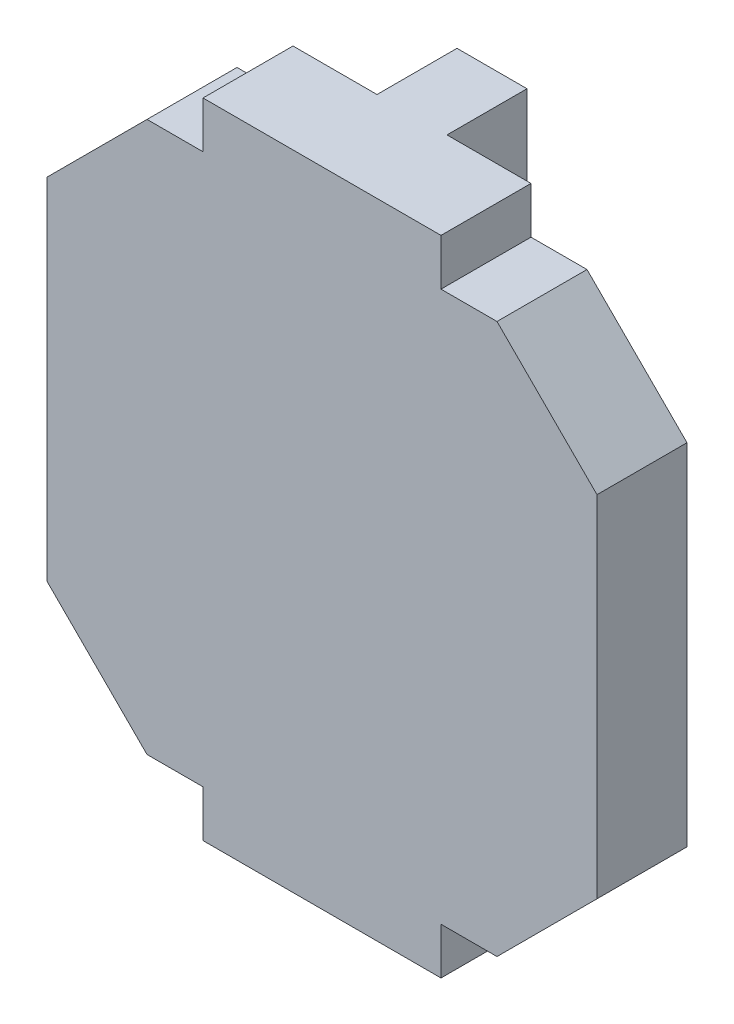
from build123d import *

# Parameters (mm, degrees)
BOSS_EXTRUDE1_DEPTH = 1.143
SKETCH2_W           = 0.889
SKETCH2_H           = 8.243996394
BOSS_EXTRUDE2_DEPTH = 1.016
CHAMFER1_SIZE       = 1.27


with BuildPart() as part:
    # Sketch1 → Boss-Extrude1 (new body)
    with BuildSketch(Plane.XY):
        Polygon((37.147499812, 66.75804972), (39.128699766, 66.758049722), (39.128699766, 66.16665148), (42.151299766, 66.166651485), (42.151299766, 66.758049727), (44.132499719, 66.758049729), (44.13249971, 73.743049637), (42.151299756, 73.743049634), (42.151299755, 74.334447876), (39.128699755, 74.334447872), (39.128699756, 73.74304963), (37.147499802, 73.743049628), align=None)
    extrude(amount=BOSS_EXTRUDE1_DEPTH)

    # Sketch2 → Boss-Extrude2 (add)
    with BuildSketch(Plane(origin=(0, 0, 0), x_dir=(-1, 0, 0), z_dir=(0, 0, -1))):
        with Locations((-40.639999755, 70.212449679)):
            Rectangle(SKETCH2_W, SKETCH2_H)
    extrude(amount=BOSS_EXTRUDE2_DEPTH)

    # Chamfer1
    chamfer1_edges = [part.edges().sort_by_distance(p)[0] for p in [
        (37.147499802, 73.743049628, 0.5715),
        (44.13249971, 73.743049637, 0.5715),
        (44.132499719, 66.758049729, 0.5715),
        (37.147499812, 66.75804972, 0.5715),
    ]]
    chamfer(chamfer1_edges, length=CHAMFER1_SIZE)


solid = part.part
